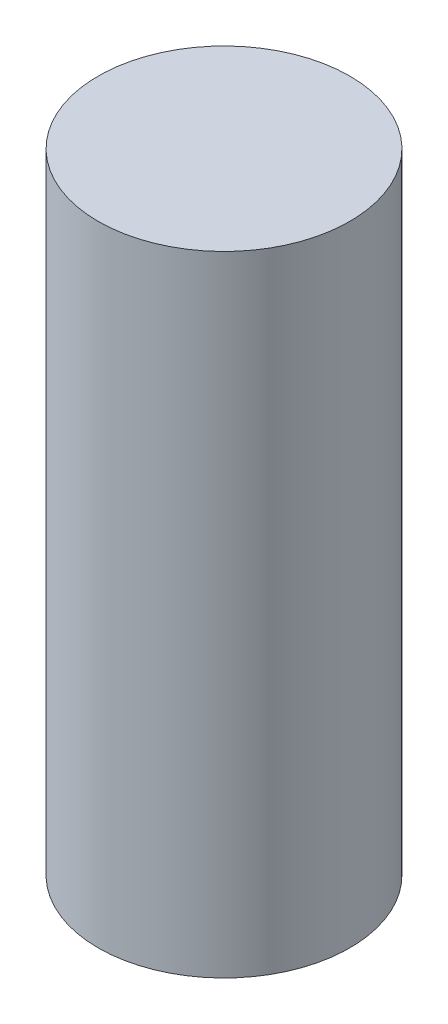
from build123d import *

# Parameters (mm, degrees)
SKIZZE1_R                       = 3
AUFSATZ_LINEAR_AUSTRAGEN1_DEPTH = 15


with BuildPart() as part:
    # Skizze1 → Aufsatz-Linear austragen1 (new body)
    with BuildSketch(Plane(origin=(0, 0, 0), x_dir=(1, 0, 0), z_dir=(0, 1, 0))):
        with Locations(Location((0, 0, 0), (0, 0, 270))):
            Circle(SKIZZE1_R)
    extrude(amount=AUFSATZ_LINEAR_AUSTRAGEN1_DEPTH)


solid = part.part
